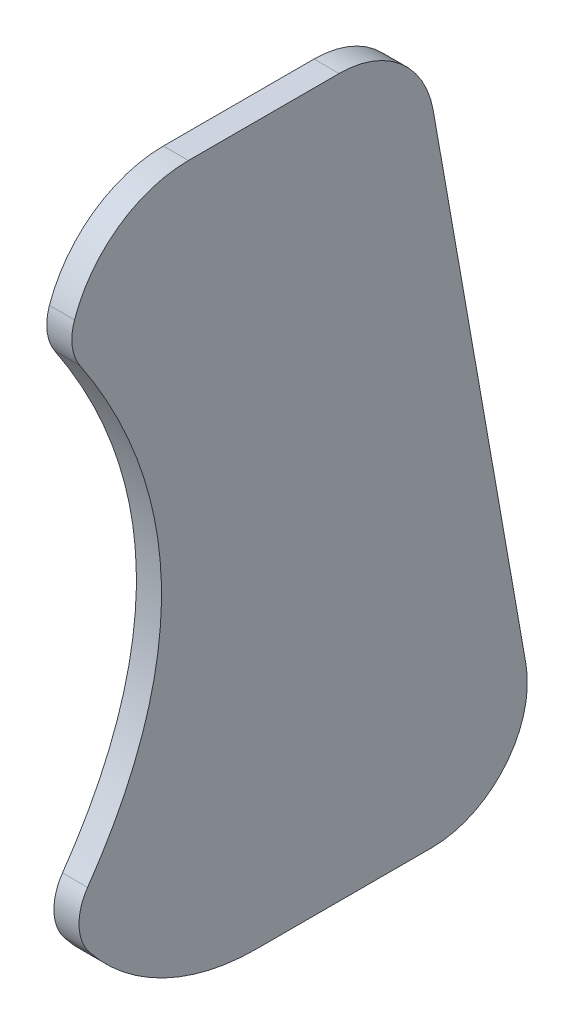
from build123d import *

# Parameters (mm, degrees)
BOSS_EXTRUDE1_DEPTH = 4
FILLET1_R           = 7.62
FILLET2_R           = 7.62


with BuildPart() as part:
    # Sketch1 → Boss-Extrude1 (new body)
    with BuildSketch(Plane(origin=(0, 0, 0), x_dir=(0, 0, -1), z_dir=(1, 0, 0))):
        with BuildLine():
            Line((-0.858815867, 31.104520152), (27.081184133, 31.104520152))
            ThreePointArc((27.081184133, 31.104520152), (38.755701446, 36.548436981), (42.089654289, 48.99091838))
            Line((42.089654289, 48.99091838), (27.309926766, 132.81091838))
            ThreePointArc((27.309926766, 132.81091838), (22.097539782, 141.839037466), (12.30145661, 145.404520152))
            Line((12.30145661, 145.404520152), (-11.714075954, 145.404520152))
            ThreePointArc((-11.714075954, 145.404520152), (-24.518671733, 140.524264284), (-30.82684486, 128.359498679))
            add(Edge.make_bspline(
                [(-30.82684486, 128.359498679), (-1.209368429, 86.647497598), (-30.82684486, 48.99091838)],
                knots=[0, 0, 0, 1, 1, 1], degree=2))
            ThreePointArc((-30.82684486, 48.99091838), (-18.308787237, 35.916095552), (-0.858815867, 31.104520152))
        make_face()
    extrude(amount=BOSS_EXTRUDE1_DEPTH)

    # Fillet1
    fillet1_edges = [part.edges().sort_by_distance(p)[0] for p in [
        (2, 128.359498679, 30.82684486),
    ]]
    fillet(fillet1_edges, radius=FILLET1_R)

    # Fillet2
    fillet2_edges = [part.edges().sort_by_distance(p)[0] for p in [
        (2, 48.99091838, 30.82684486),
    ]]
    fillet(fillet2_edges, radius=FILLET2_R)


solid = part.part
